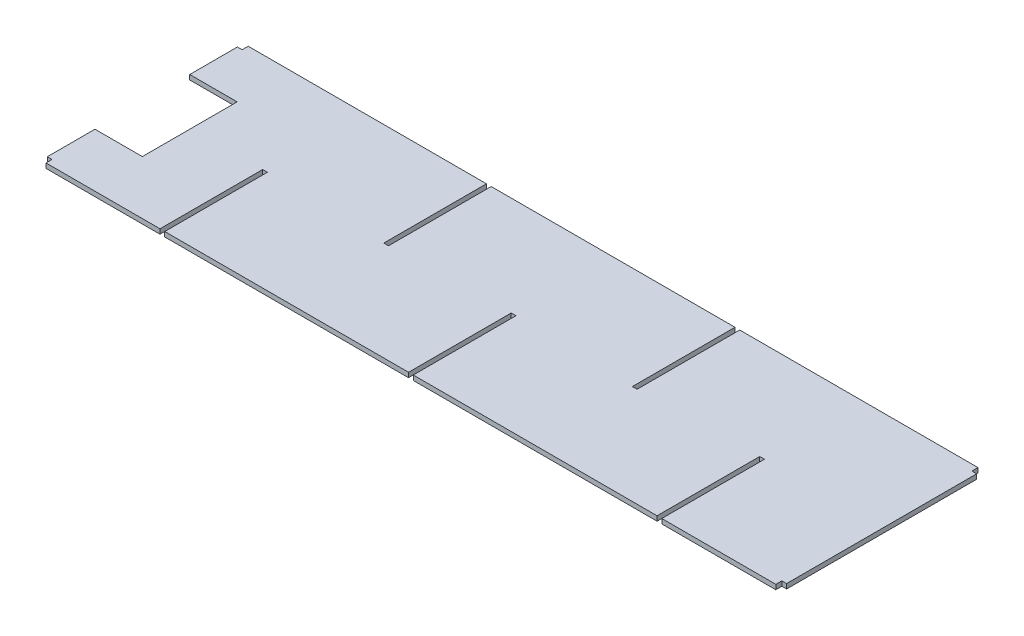
from build123d import *

# Parameters (mm, degrees)
SKETCH1_W               = 234
SKETCH1_H               = 64
BOSS_EXTRUDE1_DEPTH     = 1.5
CUT_EXTRUDE1_DEPTH      = 243.598948885
CUT_EXTRUDE1_DEPTH_BACK = 243.598948885
SKETCH2_W               = 1.5
SKETCH2_H               = 32.5
SKETCH2_H_2             = 1.915
SKETCH2_W_2             = 15
SKETCH2_H_3             = 30


with BuildPart() as part:
    # Sketch1 → Boss-Extrude1 (new body)
    with BuildSketch(Plane(origin=(0, 0, 0), x_dir=(1, 0, 0), z_dir=(0, 1, 0))):
        with Locations((117, 32)):
            Rectangle(SKETCH1_W, SKETCH1_H)
    extrude(amount=BOSS_EXTRUDE1_DEPTH)

    # Sketch2 → Cut-Extrude1 (cut, two sides: drawn at the far end of the back side and taken through both)
    with BuildSketch(Plane(origin=(0, 1.5, 0), x_dir=(1, 0, 0), z_dir=(0, 1, 0)).offset(-CUT_EXTRUDE1_DEPTH_BACK)):
        with Locations((38.333333333, 16.25)):
            Rectangle(SKETCH2_W, SKETCH2_H)
        with Locations((77.666666667, 47.75)):
            Rectangle(SKETCH2_W, SKETCH2_H)
        with Locations((117, 16.25)):
            Rectangle(SKETCH2_W, SKETCH2_H)
        with Locations((195.666666667, 16.25)):
            Rectangle(SKETCH2_W, SKETCH2_H)
        with Locations((156.333333333, 47.75)):
            Rectangle(SKETCH2_W, SKETCH2_H)
        with Locations((0.75, 0.9575)):
            Rectangle(SKETCH2_W, SKETCH2_H_2)
        with Locations((0.75, 63.0425)):
            Rectangle(SKETCH2_W, SKETCH2_H_2)
        with Locations((233.25, 63.0425)):
            Rectangle(SKETCH2_W, SKETCH2_H_2)
        with Locations((233.25, 0.9575)):
            Rectangle(SKETCH2_W, SKETCH2_H_2)
        with Locations((7.5, 32)):
            Rectangle(SKETCH2_W_2, SKETCH2_H_3)
    extrude(amount=CUT_EXTRUDE1_DEPTH + CUT_EXTRUDE1_DEPTH_BACK, mode=Mode.SUBTRACT)


solid = part.part
